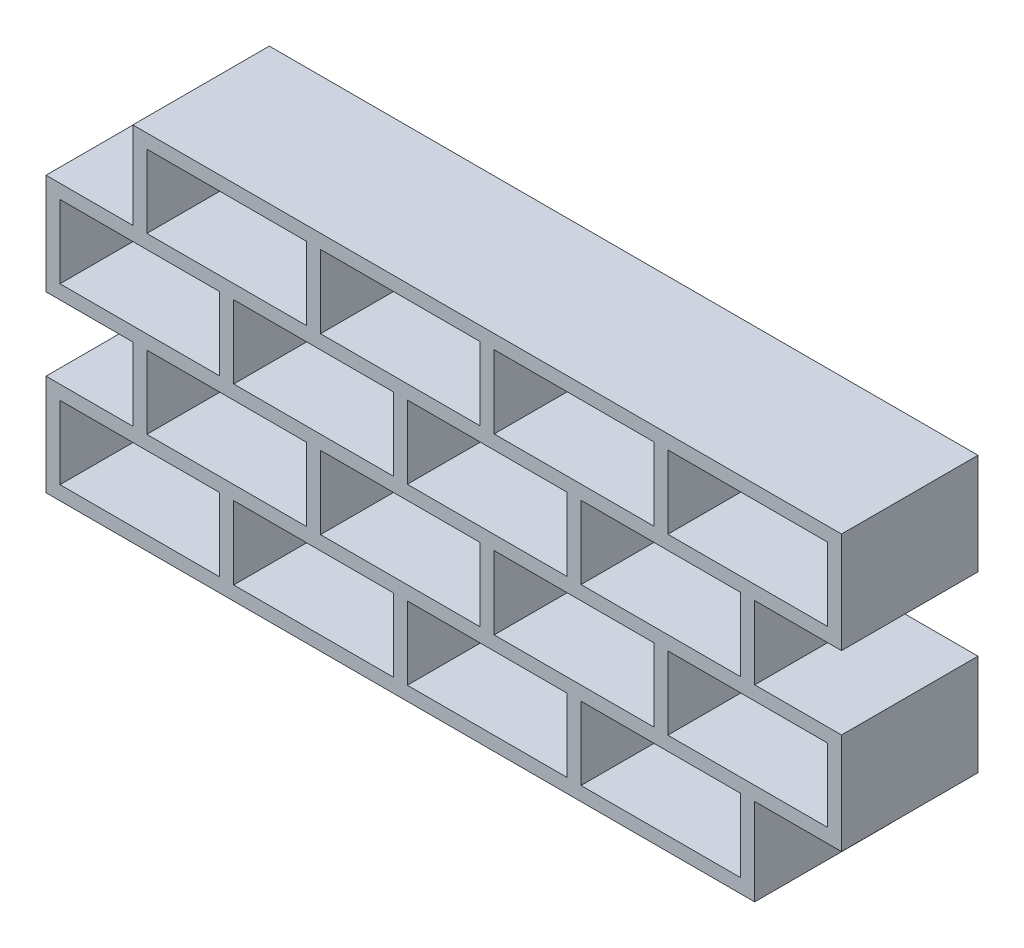
from build123d import *

# Parameters (mm, degrees)
EXTRUDE_1_DEPTH = 4


with BuildPart() as part:
    # 草图1 → 凸台-拉伸1 (new body)
    with BuildSketch(Plane.XY):
        Polygon((-2.75, 1.48), (-2.75, -1.48), (2.34, -1.48), (2.75, -1.48), (7.43, -1.48), (7.84, -1.48), (12.52, -1.48), (12.93, -1.48), (18.02, -1.48), (18.02, 1.07), (20.565, 1.07), (20.565, 4.03), (18.02, 4.03), (18.02, 6.17), (20.565, 6.17), (20.565, 9.13), (15.475, 9.13), (15.065, 9.13), (10.385, 9.13), (9.975, 9.13), (5.295, 9.13), (4.885, 9.13), (-0.205, 9.13), (-0.205, 6.58), (-2.75, 6.58), (-2.75, 3.62), (-0.205, 3.62), (-0.205, 1.48), align=None)
        Polygon((-2.34, 1.07), (-0.205, 1.07), (0.205, 1.07), (2.34, 1.07), (2.34, 0.205), (2.34, -0.205), (2.34, -1.07), (0.205, -1.07), (-0.205, -1.07), (-2.34, -1.07), (-2.34, -0.205), (-2.34, 0.205), align=None, mode=Mode.SUBTRACT)
        Polygon((2.75, 0.205), (2.75, 1.07), (4.885, 1.07), (5.295, 1.07), (7.43, 1.07), (7.43, 0.205), (7.43, -0.205), (7.43, -1.07), (5.295, -1.07), (4.885, -1.07), (2.75, -1.07), (2.75, -0.205), align=None, mode=Mode.SUBTRACT)
        Polygon((4.885, 1.48), (2.75, 1.48), (2.34, 1.48), (0.205, 1.48), (0.205, 2.345), (0.205, 2.755), (0.205, 3.62), (2.34, 3.62), (2.75, 3.62), (4.885, 3.62), (4.885, 2.755), (4.885, 2.345), align=None, mode=Mode.SUBTRACT)
        Polygon((9.975, 1.48), (7.84, 1.48), (7.43, 1.48), (5.295, 1.48), (5.295, 2.345), (5.295, 2.755), (5.295, 3.62), (7.43, 3.62), (7.84, 3.62), (9.975, 3.62), (9.975, 2.755), (9.975, 2.345), align=None, mode=Mode.SUBTRACT)
        Polygon((7.84, 0.205), (7.84, 1.07), (9.975, 1.07), (10.385, 1.07), (12.52, 1.07), (12.52, 0.205), (12.52, -0.205), (12.52, -1.07), (10.385, -1.07), (9.975, -1.07), (7.84, -1.07), (7.84, -0.205), align=None, mode=Mode.SUBTRACT)
        Polygon((12.93, 0.205), (12.93, 1.07), (15.065, 1.07), (15.475, 1.07), (17.61, 1.07), (17.61, 0.205), (17.61, -0.205), (17.61, -1.07), (15.475, -1.07), (15.065, -1.07), (12.93, -1.07), (12.93, -0.205), align=None, mode=Mode.SUBTRACT)
        Polygon((15.065, 1.48), (12.93, 1.48), (12.52, 1.48), (10.385, 1.48), (10.385, 2.345), (10.385, 2.755), (10.385, 3.62), (12.52, 3.62), (12.93, 3.62), (15.065, 3.62), (15.065, 2.755), (15.065, 2.345), align=None, mode=Mode.SUBTRACT)
        Polygon((20.155, 3.62), (20.155, 2.755), (20.155, 2.345), (20.155, 1.48), (18.02, 1.48), (17.61, 1.48), (15.475, 1.48), (15.475, 2.345), (15.475, 2.755), (15.475, 3.62), (17.61, 3.62), (18.02, 3.62), align=None, mode=Mode.SUBTRACT)
        Polygon((-0.205, 4.03), (-2.34, 4.03), (-2.34, 4.895), (-2.34, 5.305), (-2.34, 6.17), (-0.205, 6.17), (0.205, 6.17), (2.34, 6.17), (2.34, 5.305), (2.34, 4.895), (2.34, 4.03), (0.205, 4.03), align=None, mode=Mode.SUBTRACT)
        Polygon((4.885, 4.03), (2.75, 4.03), (2.75, 4.895), (2.75, 5.305), (2.75, 6.17), (4.885, 6.17), (5.295, 6.17), (7.43, 6.17), (7.43, 5.305), (7.43, 4.895), (7.43, 4.03), (5.295, 4.03), align=None, mode=Mode.SUBTRACT)
        Polygon((4.885, 6.58), (2.75, 6.58), (2.34, 6.58), (0.205, 6.58), (0.205, 7.445), (0.205, 7.855), (0.205, 8.72), (2.34, 8.72), (2.75, 8.72), (4.885, 8.72), (4.885, 7.855), (4.885, 7.445), align=None, mode=Mode.SUBTRACT)
        Polygon((5.295, 7.445), (5.295, 7.855), (5.295, 8.72), (7.43, 8.72), (7.84, 8.72), (9.975, 8.72), (9.975, 7.855), (9.975, 7.445), (9.975, 6.58), (7.84, 6.58), (7.43, 6.58), (5.295, 6.58), align=None, mode=Mode.SUBTRACT)
        Polygon((9.975, 4.03), (7.84, 4.03), (7.84, 4.895), (7.84, 5.305), (7.84, 6.17), (9.975, 6.17), (10.385, 6.17), (12.52, 6.17), (12.52, 5.305), (12.52, 4.895), (12.52, 4.03), (10.385, 4.03), align=None, mode=Mode.SUBTRACT)
        Polygon((15.065, 4.03), (12.93, 4.03), (12.93, 4.895), (12.93, 5.305), (12.93, 6.17), (15.065, 6.17), (15.475, 6.17), (17.61, 6.17), (17.61, 5.305), (17.61, 4.895), (17.61, 4.03), (15.475, 4.03), align=None, mode=Mode.SUBTRACT)
        Polygon((10.385, 7.445), (10.385, 7.855), (10.385, 8.72), (12.52, 8.72), (12.93, 8.72), (15.065, 8.72), (15.065, 7.855), (15.065, 7.445), (15.065, 6.58), (12.93, 6.58), (12.52, 6.58), (10.385, 6.58), align=None, mode=Mode.SUBTRACT)
        Polygon((15.475, 7.445), (15.475, 7.855), (15.475, 8.72), (17.61, 8.72), (18.02, 8.72), (20.155, 8.72), (20.155, 6.58), (18.02, 6.58), (17.61, 6.58), (15.475, 6.58), align=None, mode=Mode.SUBTRACT)
    extrude(amount=EXTRUDE_1_DEPTH)


solid = part.part
